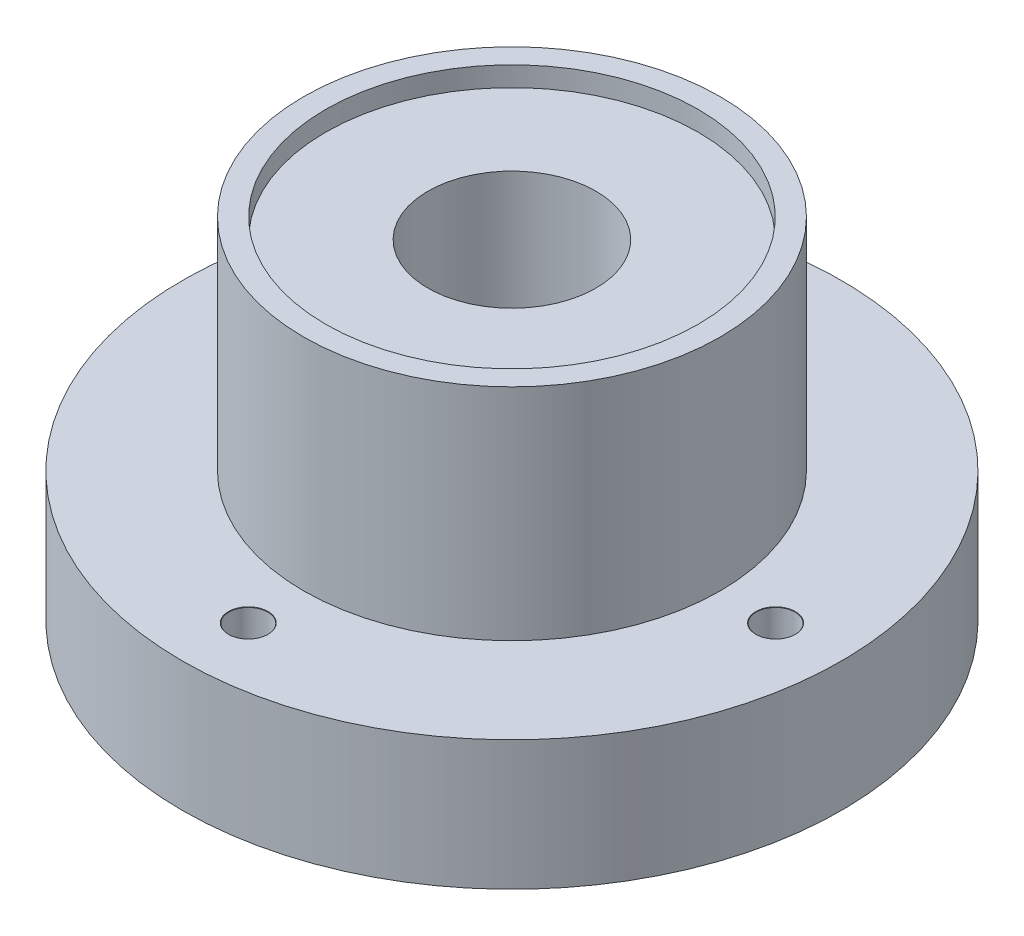
from build123d import *

# Parameters (mm, degrees)
SKETCH1_R                       = 25.4
BOSS_EXTRUDE1_DEPTH             = 25.4
SKETCH2_OUTSIDE_W               = 68.04
SKETCH2_OUTSIDE_H               = 68.04
SKETCH2_OUTSIDE_R               = 16.05
CUT_EXTRUDE1_DEPTH              = 15.422
SKETCH3_R                       = 6.477
CUT_EXTRUDE2_DEPTH              = 44.994090512
BOSS_EXTRUDE2_START             = 1.524
SKETCH4_R                       = 16.05
SKETCH4_R_2                     = 14.351
BOSS_EXTRUDE2_DEPTH             = 1.524
F_3_0MM_DOWEL_HOLE1_D           = 3
F_3_0MM_DOWEL_HOLE1_CSINK_D     = 3.05
F_3_0MM_DOWEL_HOLE1_CSINK_ANGLE = 90
CIRPATTERN1_COUNT               = 4


with BuildPart() as part:
    # Sketch1 → Boss-Extrude1 (new body)
    with BuildSketch(Plane(origin=(0, 0, 0), x_dir=(1, 0, 0), z_dir=(0, 1, 0))):
        with Locations(Location((0, 0, 0), (0, 0, 270))):
            Circle(SKETCH1_R)
    extrude(amount=BOSS_EXTRUDE1_DEPTH)

    # Sketch2 outside → Cut-Extrude1 (cut)
    with BuildSketch(Plane(origin=(0, 25.4, 0), x_dir=(1, 0, 0), z_dir=(0, 1, 0))):
        Rectangle(SKETCH2_OUTSIDE_W, SKETCH2_OUTSIDE_H)
        with Locations(Location((0, 0, 0), (0, 0, 270))):
            Circle(SKETCH2_OUTSIDE_R, mode=Mode.SUBTRACT)
    extrude(amount=-CUT_EXTRUDE1_DEPTH, mode=Mode.SUBTRACT)

    # Sketch3 → Cut-Extrude2 (cut, through all)
    with BuildSketch(Plane.XZ):
        with Locations(Location((0, 0, 0), (0, 0, 270))):
            Circle(SKETCH3_R)
    extrude(amount=-CUT_EXTRUDE2_DEPTH, mode=Mode.SUBTRACT)

    # Sketch4 → Boss-Extrude2 (add)
    with BuildSketch(Plane(origin=(0, 25.4, 0), x_dir=(1, 0, 0), z_dir=(0, 1, 0)).offset(BOSS_EXTRUDE2_START)):
        with Locations(Location((0, 0, 0), (0, 0, 270))):
            Circle(SKETCH4_R)
        with Locations(Location((0, 0, 0), (0, 0, 90))):
            Circle(SKETCH4_R_2, mode=Mode.SUBTRACT)
    extrude(amount=-BOSS_EXTRUDE2_DEPTH)

    # Ø3.0mm Dowel Hole1 (through all)
    with Locations(Plane(origin=(0, 9.978, -20.32), x_dir=(0, 0, 1), z_dir=(0, 1, 0))):
        with Locations((0, 0)):
            f_3_0mm_dowel_hole1 = CounterSinkHole(F_3_0MM_DOWEL_HOLE1_D / 2, F_3_0MM_DOWEL_HOLE1_CSINK_D / 2, counter_sink_angle=F_3_0MM_DOWEL_HOLE1_CSINK_ANGLE)

    # CirPattern1: Ø3.0mm Dowel Hole1 ×4 about axis
    cirpattern1_axis = Axis((0, 0, 0), (0, 1, 0))
    for i in range(1, CIRPATTERN1_COUNT):
        add(f_3_0mm_dowel_hole1.rotate(cirpattern1_axis, i * 360 / CIRPATTERN1_COUNT), mode=Mode.SUBTRACT)


solid = part.part
